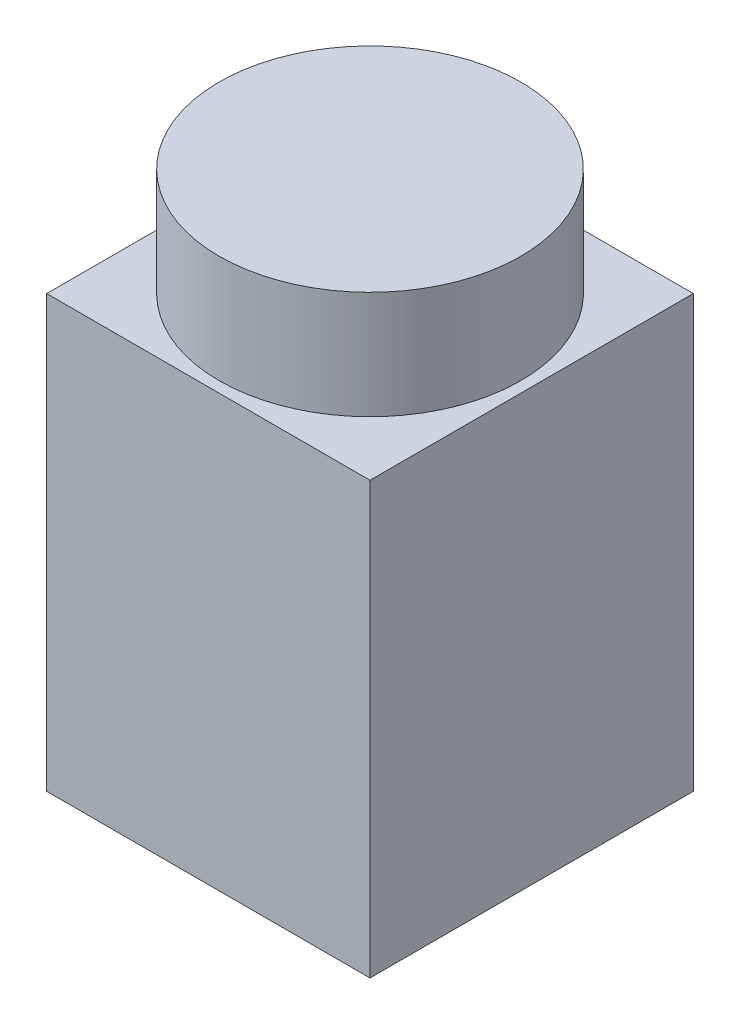
from build123d import *

# Parameters (mm, degrees)
SKETCH1_W           = 30
SKETCH1_H           = 30
BOSS_EXTRUDE1_DEPTH = 40
SKETCH2_R           = 14
BOSS_EXTRUDE2_DEPTH = 10


with BuildPart() as part:
    # Sketch1 → Boss-Extrude1 (new body)
    with BuildSketch(Plane(origin=(0, 0, 0), x_dir=(1, 0, 0), z_dir=(0, 1, 0))):
        with Locations((15, 15)):
            Rectangle(SKETCH1_W, SKETCH1_H)
    extrude(amount=BOSS_EXTRUDE1_DEPTH)

    # Sketch2 → Boss-Extrude2 (add)
    with BuildSketch(Plane(origin=(0, 40, 0), x_dir=(1, 0, 0), z_dir=(0, 1, 0))):
        with Locations(Location((15, 15, 0), (0, 0, 270))):
            Circle(SKETCH2_R)
    extrude(amount=BOSS_EXTRUDE2_DEPTH)


solid = part.part
